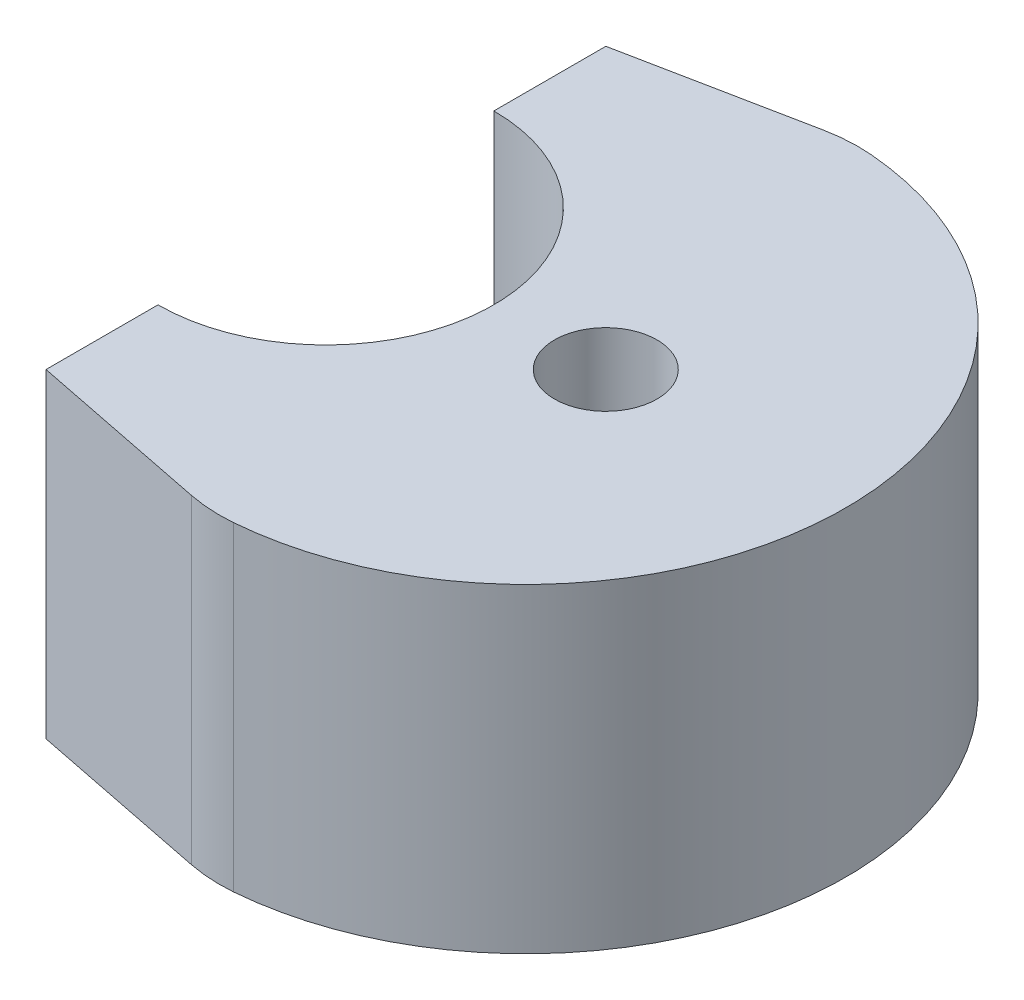
from build123d import *

# Parameters (mm, degrees)
SKETCH1_R           = 0.3207
BOSS_EXTRUDE1_DEPTH = 0.5
BOSS_EXTRUDE2_START = 0.5
SKETCH1_20_R        = 0.3207
BOSS_EXTRUDE2_DEPTH = 1.5


with BuildPart() as part:
    # Sketch1 → Boss-Extrude1 (new body)
    with BuildSketch(Plane(origin=(0, 0, 0), x_dir=(1, 0, 0), z_dir=(0, 1, 0))):
        with BuildLine():
            ThreePointArc((0.164100898, 1.993256355), (0.024548564, 1.994973575), (-0.11388376, 1.977245221))
            Line((-0.11388376, 1.977245221), (-1.25, 1.750241174))
            Line((-1.25, 1.750241174), (-1.25, 1.25))
            ThreePointArc((-1.25, 1.25), (-0.366116524, 0.883883476), (0, 0))
            ThreePointArc((0, 0), (-0.366116524, -0.883883476), (-1.25, -1.25))
            Line((-1.25, -1.25), (-1.25, -1.750241174))
            Line((-1.25, -1.750241174), (-0.11388376, -1.977245221))
            ThreePointArc((-0.11388376, -1.977245221), (0.024548564, -1.994973575), (0.164100898, -1.993256355))
            ThreePointArc((0.164100898, -1.993256355), (2, 0), (0.164100898, 1.993256355))
        make_face()
        with Locations((0.5, 0)):
            Circle(SKETCH1_R, mode=Mode.SUBTRACT)
    extrude(amount=BOSS_EXTRUDE1_DEPTH)

    # Sketch1<20> → Boss-Extrude2 (add)
    with BuildSketch(Plane(origin=(0, 0, 0), x_dir=(1, 0, 0), z_dir=(0, 1, 0)).offset(BOSS_EXTRUDE2_START)):
        with BuildLine():
            ThreePointArc((0.164100898, 1.993256355), (0.024548564, 1.994973575), (-0.11388376, 1.977245221))
            Line((-0.11388376, 1.977245221), (-1.25, 1.750241174))
            Line((-1.25, 1.750241174), (-1.25, 1.05))
            ThreePointArc((-1.25, 1.05), (-0.2, 0), (-1.25, -1.05))
            Line((-1.25, -1.05), (-1.25, -1.750241174))
            Line((-1.25, -1.750241174), (-0.11388376, -1.977245221))
            ThreePointArc((-0.11388376, -1.977245221), (0.024548564, -1.994973575), (0.164100898, -1.993256355))
            ThreePointArc((0.164100898, -1.993256355), (2, 0), (0.164100898, 1.993256355))
        make_face()
        with Locations((0.5, 0)):
            Circle(SKETCH1_20_R, mode=Mode.SUBTRACT)
    extrude(amount=BOSS_EXTRUDE2_DEPTH)


solid = part.part
